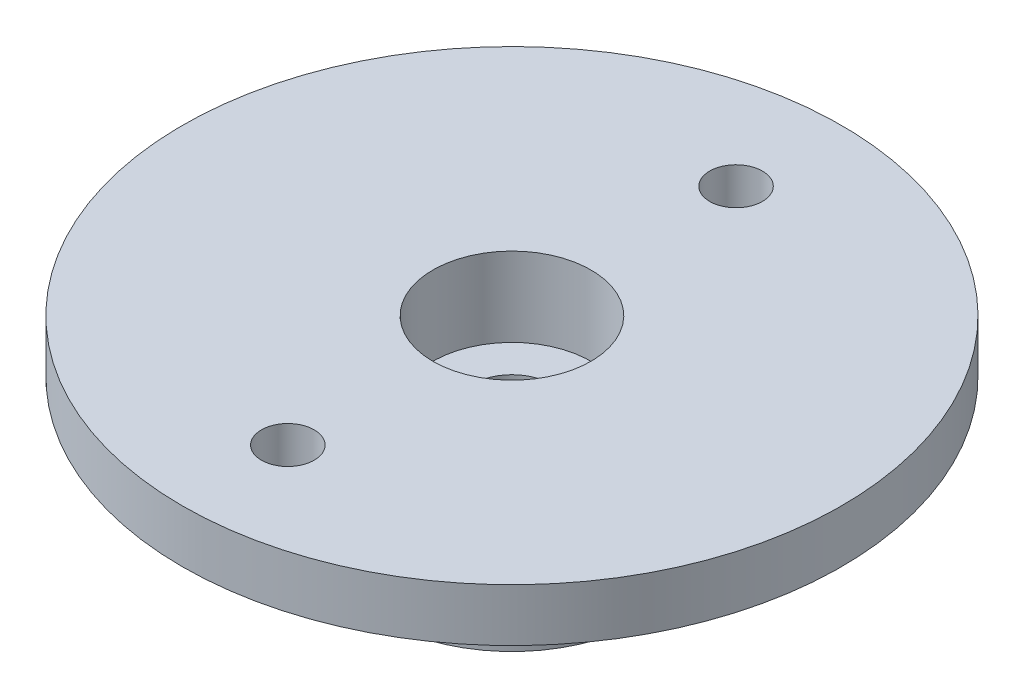
from build123d import *

# Parameters (mm, degrees)
SKETCH1_R           = 12.5
BOSS_EXTRUDE1_DEPTH = 2
SKETCH2_R           = 5
BOSS_EXTRUDE2_DEPTH = 5.5
SKETCH3_R           = 2.75
CUT_EXTRUDE1_DEPTH  = 3
CUT_EXTRUDE2_REACH  = 21.203
SKETCH4_R           = 1
SKETCH5_R           = 3
CUT_EXTRUDE3_DEPTH  = 3
CUT_EXTRUDE4_REACH  = 20.241
SKETCH6_R           = 1.5


with BuildPart() as part:
    # Sketch1 → Boss-Extrude1 (new body)
    with BuildSketch(Plane(origin=(0, 0, 0), x_dir=(1, 0, 0), z_dir=(0, 1, 0))):
        with Locations(Location((0, 0, 0), (0, 0, 270))):
            Circle(SKETCH1_R)
    extrude(amount=BOSS_EXTRUDE1_DEPTH)

    # Sketch2 → Boss-Extrude2 (add)
    with BuildSketch(Plane.XZ):
        with Locations(Location((0, 0, 0), (0, 0, 90))):
            Circle(SKETCH2_R)
    extrude(amount=BOSS_EXTRUDE2_DEPTH)

    # Sketch3 → Cut-Extrude1 (cut)
    with BuildSketch(Plane.XZ.offset(5.5)):
        with Locations(Location((0, 0, 0), (0, 0, 270))):
            Circle(SKETCH3_R)
    extrude(amount=-CUT_EXTRUDE1_DEPTH, mode=Mode.SUBTRACT)

    # Sketch4 → Cut-Extrude2 (cut, up to next)
    with BuildSketch(Plane(origin=(0, 2, 0), x_dir=(1, 0, 0), z_dir=(0, 1, 0)), mode=Mode.PRIVATE) as cut_extrude2_sk1:
        with Locations(Location((0, 8.5, 0), (0, 0, 270))):
            Circle(SKETCH4_R)
    cut_extrude2_tool1 = extrude(cut_extrude2_sk1.sketch, amount=-CUT_EXTRUDE2_REACH, mode=Mode.PRIVATE) & part.part
    # Sketch4 → Cut-Extrude2 (cut, up to next)
    with BuildSketch(Plane(origin=(0, 2, 0), x_dir=(1, 0, 0), z_dir=(0, 1, 0)), mode=Mode.PRIVATE) as cut_extrude2_sk2:
        with Locations(Location((0, -8.5, 0), (0, 0, 270))):
            Circle(SKETCH4_R)
    cut_extrude2_tool2 = extrude(cut_extrude2_sk2.sketch, amount=-CUT_EXTRUDE2_REACH, mode=Mode.PRIVATE) & part.part
    add(cut_extrude2_tool1.solids().sort_by_distance((0, 2, -8.5))[0], mode=Mode.SUBTRACT)
    add(cut_extrude2_tool2.solids().sort_by_distance((0, 2, 8.5))[0], mode=Mode.SUBTRACT)

    # Sketch5 → Cut-Extrude3 (cut)
    with BuildSketch(Plane(origin=(0, 2, 0), x_dir=(1, 0, 0), z_dir=(0, 1, 0))):
        with Locations(Location((0, 0, 0), (0, 0, 270))):
            Circle(SKETCH5_R)
    extrude(amount=-CUT_EXTRUDE3_DEPTH, mode=Mode.SUBTRACT)

    # Sketch6 → Cut-Extrude4 (cut, up to next)
    with BuildSketch(Plane(origin=(0, -1, 0), x_dir=(1, 0, 0), z_dir=(0, 1, 0)), mode=Mode.PRIVATE) as cut_extrude4_sk1:
        with Locations(Location((0, 0, 0), (0, 0, 270))):
            Circle(SKETCH6_R)
    cut_extrude4_tool1 = extrude(cut_extrude4_sk1.sketch, amount=-CUT_EXTRUDE4_REACH, mode=Mode.PRIVATE) & part.part
    add(cut_extrude4_tool1.solids().sort_by_distance((0, -1, 0))[0], mode=Mode.SUBTRACT)


solid = part.part
